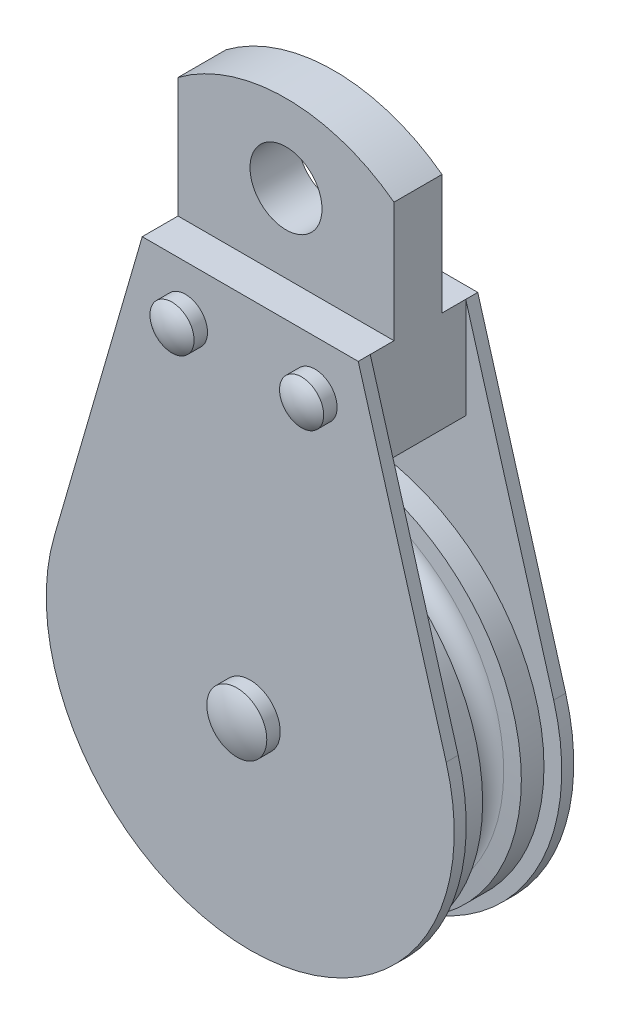
from build123d import *

# Parameters (mm, degrees)
BOSS_EXTRUDE1_DEPTH = 1.5875
SKETCH5_W           = 28.575
SKETCH5_H           = 13.335
BOSS_EXTRUDE2_DEPTH = 6.31825
SKETCH32_R          = 4.7625
BOSS_EXTRUDE9_DEPTH = 3.175
SKETCH6_R           = 3.96875
SKETCH6_R_2         = 2.921
BOSS_EXTRUDE3_DEPTH = 1.778
DOME1_FACE_RADIUS   = 2.921
DOME1_HEIGHT        = 1.016
DOME3_FACE_RADIUS   = 2.921
DOME3_HEIGHT        = 1.016
DOME4_FACE_RADIUS   = 3.96875
DOME4_HEIGHT        = 1.016
SKETCH8_R           = 4.191
SKETCH8_R_2         = 6.35
BOSS_EXTRUDE4_DEPTH = 1.778
DOME5_FACE_RADIUS   = 4.191
DOME5_HEIGHT        = 2.54
DOME6_FACE_RADIUS   = 4.191
DOME6_HEIGHT        = 2.54
DOME7_FACE_RADIUS   = 6.35
DOME7_HEIGHT        = 3.9624
SKETCH9_R           = 3.57505
BOSS_EXTRUDE5_DEPTH = 15.8115


with BuildPart() as part:
    # Sketch3 → Revolve1 (revolve)
    with BuildSketch(Plane(origin=(0, 0, 0), x_dir=(0, 0, -1), z_dir=(1, 0, 0)), mode=Mode.PRIVATE) as revolve1_sk:
        with BuildLine():
            Line((-5.55625, 25.4), (-5.55625, 0))
            Line((-5.55625, 0), (5.55625, 0))
            Line((5.55625, 0), (5.55625, 25.4))
            Line((5.55625, 25.4), (2.559789657, 25.4))
            Line((2.559789657, 25.4), (2.372188625, 23.255710388))
            ThreePointArc((2.372188625, 23.255710388), (0, 21.082), (-2.372188625, 23.255710388))
            Line((-2.372188625, 23.255710388), (-2.559789657, 25.4))
            Line((-2.559789657, 25.4), (-5.55625, 25.4))
        make_face()
    revolve(revolve1_sk.sketch.rotate(Axis((0, 0, 5.55625), (0, 0, -1)), 90), axis=Axis((0, 0, 5.55625), (0, 0, -1)))



with BuildPart() as body_2:
    # Sketch4 → Boss-Extrude1 (new body)
    with BuildSketch(Plane.XY.offset(6.31825)):
        with BuildLine():
            Line((14.2875, 47.625), (-14.2875, 47.625))
            Line((-14.2875, 47.625), (-25.919465871, 7.517076905))
            ThreePointArc((-25.919465871, 7.517076905), (0, -26.9875), (25.919465871, 7.517076905))
            Line((25.919465871, 7.517076905), (14.2875, 47.625))
        make_face()
    extrude(amount=BOSS_EXTRUDE1_DEPTH)

    # Sketch5 → Boss-Extrude2 (add)
    with BuildSketch(Plane(origin=(0, 0, 6.31825), x_dir=(-1, 0, 0), z_dir=(0, 0, -1))):
        with Locations((0, 40.9575)):
            Rectangle(SKETCH5_W, SKETCH5_H)
    extrude(amount=BOSS_EXTRUDE2_DEPTH)

    # Mirror1: body 2 across plane


with BuildPart() as body_2_1:
    add(body_2.part)
    add(body_2.part.mirror(Plane.XY))

    # Sketch32 → Boss-Extrude9 (add, symmetric)
    with BuildSketch(Plane.XY):
        with BuildLine():
            Line((14.2875, 63.5), (14.2875, 34.29))
            Line((14.2875, 34.29), (-14.2875, 34.29))
            Line((-14.2875, 34.29), (-14.2875, 63.5))
            ThreePointArc((-14.2875, 63.5), (0, 68.2625), (14.2875, 63.5))
        make_face()
        with Locations((0, 57.94375)):
            Circle(SKETCH32_R, mode=Mode.SUBTRACT)
    extrude(amount=BOSS_EXTRUDE9_DEPTH, both=True)

    # Sketch6 → Boss-Extrude3 (add)
    with BuildSketch(Plane.XY.offset(7.90575)):
        Circle(SKETCH6_R)
        with Locations((-8.5725, 40.9575)):
            Circle(SKETCH6_R_2)
        with Locations((8.5725, 40.9575)):
            Circle(SKETCH6_R_2)
    extrude(amount=BOSS_EXTRUDE3_DEPTH)

    # Dome1: a dome of height H over a round flat face of radius A is a cap of a sphere of radius (A * A + H * H) / (2 * H)
    dome1_r = (DOME1_FACE_RADIUS * DOME1_FACE_RADIUS + DOME1_HEIGHT * DOME1_HEIGHT) / (2 * DOME1_HEIGHT)
    dome1_base = Plane((-8.5725, 40.9575, 9.68375), z_dir=(0, 0, 1))
    with Locations(dome1_base.offset(DOME1_HEIGHT - dome1_r)):
        dome1_ball = Sphere(dome1_r, mode=Mode.PRIVATE)
    add(split(dome1_ball, bisect_by=dome1_base, keep=Keep.TOP, mode=Mode.PRIVATE))

    # Dome3: a dome of height H over a round flat face of radius A is a cap of a sphere of radius (A * A + H * H) / (2 * H)
    dome3_r = (DOME3_FACE_RADIUS * DOME3_FACE_RADIUS + DOME3_HEIGHT * DOME3_HEIGHT) / (2 * DOME3_HEIGHT)
    dome3_base = Plane((8.5725, 40.9575, 9.68375), z_dir=(0, 0, 1))
    with Locations(dome3_base.offset(DOME3_HEIGHT - dome3_r)):
        dome3_ball = Sphere(dome3_r, mode=Mode.PRIVATE)
    add(split(dome3_ball, bisect_by=dome3_base, keep=Keep.TOP, mode=Mode.PRIVATE))

    # Dome4: a dome of height H over a round flat face of radius A is a cap of a sphere of radius (A * A + H * H) / (2 * H)
    dome4_r = (DOME4_FACE_RADIUS * DOME4_FACE_RADIUS + DOME4_HEIGHT * DOME4_HEIGHT) / (2 * DOME4_HEIGHT)
    dome4_base = Plane((0, 0, 9.68375), z_dir=(0, 0, 1))
    with Locations(dome4_base.offset(DOME4_HEIGHT - dome4_r)):
        dome4_ball = Sphere(dome4_r, mode=Mode.PRIVATE)
    add(split(dome4_ball, bisect_by=dome4_base, keep=Keep.TOP, mode=Mode.PRIVATE))

    # Sketch8 → Boss-Extrude4 (add)
    with BuildSketch(Plane(origin=(0, 0, -7.90575), x_dir=(-1, 0, 0), z_dir=(0, 0, -1))):
        with Locations((-8.5725, 40.9575)):
            Circle(SKETCH8_R)
        with Locations((8.5725, 40.9575)):
            Circle(SKETCH8_R)
        Circle(SKETCH8_R_2)
    extrude(amount=BOSS_EXTRUDE4_DEPTH)

    # Dome5: a dome of height H over a round flat face of radius A is a cap of a sphere of radius (A * A + H * H) / (2 * H)
    dome5_r = (DOME5_FACE_RADIUS * DOME5_FACE_RADIUS + DOME5_HEIGHT * DOME5_HEIGHT) / (2 * DOME5_HEIGHT)
    dome5_base = Plane((8.5725, 40.9575, -9.68375), z_dir=(0, 0, -1))
    with Locations(dome5_base.offset(DOME5_HEIGHT - dome5_r)):
        dome5_ball = Sphere(dome5_r, mode=Mode.PRIVATE)
    add(split(dome5_ball, bisect_by=dome5_base, keep=Keep.TOP, mode=Mode.PRIVATE))

    # Dome6: a dome of height H over a round flat face of radius A is a cap of a sphere of radius (A * A + H * H) / (2 * H)
    dome6_r = (DOME6_FACE_RADIUS * DOME6_FACE_RADIUS + DOME6_HEIGHT * DOME6_HEIGHT) / (2 * DOME6_HEIGHT)
    dome6_base = Plane((-8.5725, 40.9575, -9.68375), z_dir=(0, 0, -1))
    with Locations(dome6_base.offset(DOME6_HEIGHT - dome6_r)):
        dome6_ball = Sphere(dome6_r, mode=Mode.PRIVATE)
    add(split(dome6_ball, bisect_by=dome6_base, keep=Keep.TOP, mode=Mode.PRIVATE))

    # Dome7: a dome of height H over a round flat face of radius A is a cap of a sphere of radius (A * A + H * H) / (2 * H)
    dome7_r = (DOME7_FACE_RADIUS * DOME7_FACE_RADIUS + DOME7_HEIGHT * DOME7_HEIGHT) / (2 * DOME7_HEIGHT)
    dome7_base = Plane((0, 0, -9.68375), z_dir=(0, 0, -1))
    with Locations(dome7_base.offset(DOME7_HEIGHT - dome7_r)):
        dome7_ball = Sphere(dome7_r, mode=Mode.PRIVATE)
    add(split(dome7_ball, bisect_by=dome7_base, keep=Keep.TOP, mode=Mode.PRIVATE))


with BuildPart() as part_1:
    add(part.part)

    add(body_2_1.part)  # Boss-Extrude5 merges body 2
    # Sketch9 → Boss-Extrude5 (add)
    with BuildSketch(Plane.XY.offset(7.90575)):
        Circle(SKETCH9_R)
    extrude(amount=-BOSS_EXTRUDE5_DEPTH)


solid = part_1.part
